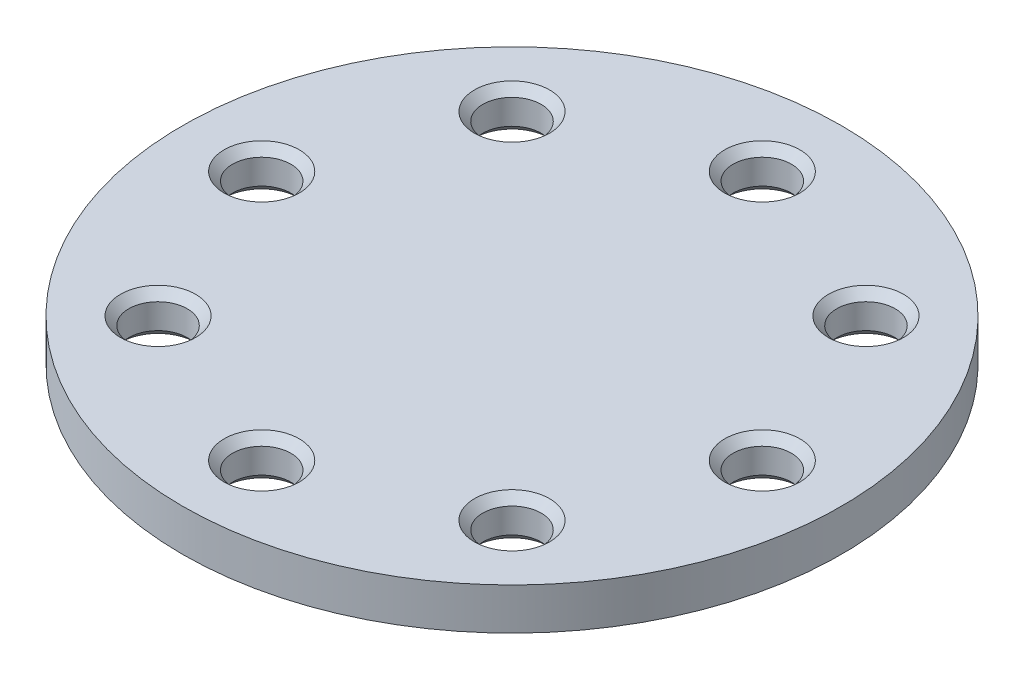
from build123d import *

# Parameters (mm, degrees)
ESBO_O1_R                = 39.5
ESBO_O1_R_2              = 3.5
RESSALTO_EXTRUS_O1_DEPTH = 5
CHANFRO1_SIZE            = 1


with BuildPart() as part:
    # Esboço1 → Ressalto-extrusão1 (new body)
    with BuildSketch(Plane(origin=(0, 0, 0), x_dir=(1, 0, 0), z_dir=(0, 1, 0))):
        with Locations(Location((0, 0, 0), (0, 0, 270))):
            Circle(ESBO_O1_R)
        with Locations(Location((-21.213203436, 21.213203436, 0), (0, 0, 270))):
            Circle(ESBO_O1_R_2, mode=Mode.SUBTRACT)
        with Locations(Location((-21.213203436, -21.213203436, 0), (0, 0, 270))):
            Circle(ESBO_O1_R_2, mode=Mode.SUBTRACT)
        with Locations(Location((21.213203436, -21.213203436, 0), (0, 0, 270))):
            Circle(ESBO_O1_R_2, mode=Mode.SUBTRACT)
        with Locations(Location((21.213203436, 21.213203436, 0), (0, 0, 270))):
            Circle(ESBO_O1_R_2, mode=Mode.SUBTRACT)
        with Locations(Location((-30, 0, 0), (0, 0, 270))):
            Circle(ESBO_O1_R_2, mode=Mode.SUBTRACT)
        with Locations(Location((0, -30, 0), (0, 0, 270))):
            Circle(ESBO_O1_R_2, mode=Mode.SUBTRACT)
        with Locations(Location((30, 0, 0), (0, 0, 270))):
            Circle(ESBO_O1_R_2, mode=Mode.SUBTRACT)
        with Locations(Location((0, 30, 0), (0, 0, 270))):
            Circle(ESBO_O1_R_2, mode=Mode.SUBTRACT)
    extrude(amount=RESSALTO_EXTRUS_O1_DEPTH)

    # Chanfro1
    chanfro1_edges = [part.edges().sort_by_distance(p)[0] for p in [
        (0, 0, -33.5),
        (30, 0, -3.5),
        (-21.213203436, 5, -24.713203436),
        (0, 0, 26.5),
        (-30, 0, -3.5),
        (21.213203436, 0, -24.713203436),
        (21.213203436, 0, 17.713203436),
        (-21.213203436, 0, 17.713203436),
        (-21.213203436, 0, -24.713203436),
        (-21.213203436, 5, 17.713203436),
        (21.213203436, 5, 17.713203436),
        (21.213203436, 5, -24.713203436),
        (-30, 5, -3.5),
        (0, 5, 26.5),
        (30, 5, -3.5),
        (0, 5, -33.5),
    ]]
    chamfer(chanfro1_edges, length=CHANFRO1_SIZE)


solid = part.part
